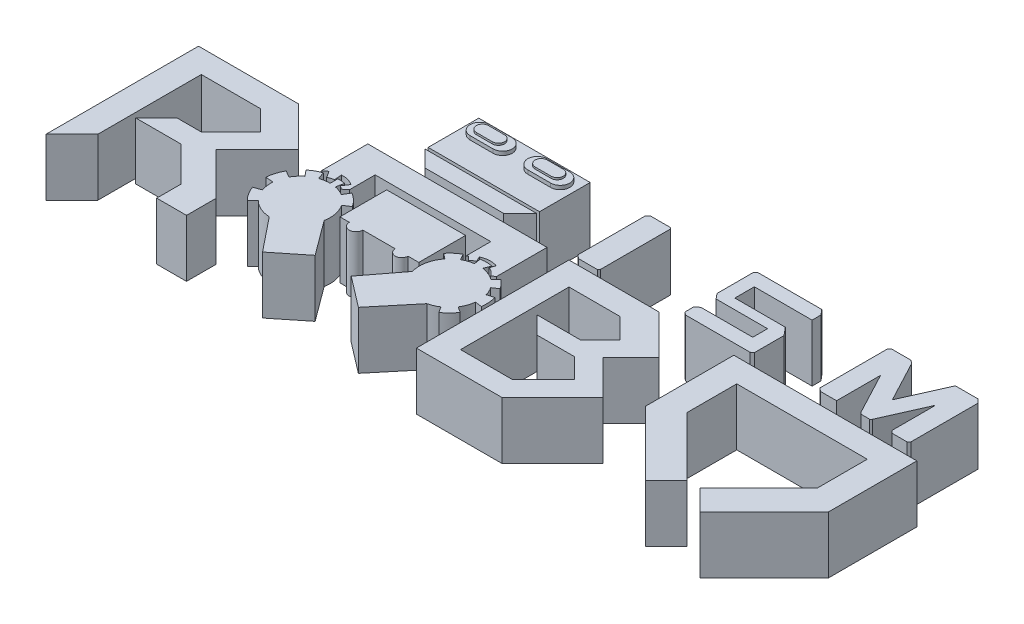
from build123d import *

# Parameters (mm, degrees)
BOSS_EXTRUDE1_DEPTH    = 15
BOSS_EXTRUDE1_2_DEPTH  = 15
BOSS_EXTRUDE1_3_DEPTH  = 15
BOSS_EXTRUDE1_4_DEPTH  = 15
BOSS_EXTRUDE1_5_DEPTH  = 15
BOSS_EXTRUDE1_6_DEPTH  = 15
SKETCH1_W              = 29.217576967
SKETCH1_H              = 13.279726958
BOSS_EXTRUDE1_7_DEPTH  = 15
BOSS_EXTRUDE1_8_DEPTH  = 15
BOSS_EXTRUDE1_9_DEPTH  = 15
BOSS_EXTRUDE1_10_DEPTH = 15
BOSS_EXTRUDE1_11_DEPTH = 15
BOSS_EXTRUDE1_12_DEPTH = 15
BOSS_EXTRUDE2_DEPTH    = 1
BOSS_EXTRUDE3_DEPTH    = 0.5


with BuildPart() as part:
    # Sketch1 → Boss-Extrude1 (new body)
    with BuildSketch(Plane(origin=(0, 0, 0), x_dir=(1, 0, 0), z_dir=(0, 1, 0))):
        Polygon((-166.060737531, 37.359722865), (-166.060737531, -2.640277135), (-159.262334495, 4.1581259), (-159.262334495, 31.288511702), (-143.776071096, 31.288511702), (-138.411695689, 25.924136295), (-146.100802771, 18.235029213), (-152.623896964, 18.235029213), (-158.034067728, 12.824858448), (-146.06823681, 12.824858448), (-137.027974425, 3.784596063), (-137.027974425, -2.640277135), (-129.20994928, -2.640277135), (-129.20994928, 5.099131264), (-140.245126365, 16.134308349), (-129.452100501, 26.927334212), (-139.884489154, 37.359722865), align=None)
    extrude(amount=BOSS_EXTRUDE1_DEPTH)


with BuildPart() as body_2:
    # Sketch1 → Boss-Extrude1 2 (new body)
    with BuildSketch(Plane(origin=(0, 0, 0), x_dir=(1, 0, 0), z_dir=(0, 1, 0))):
        with BuildLine():
            Line((-121.666954469, 37.359722865), (-121.666954469, 25.091839616))
            ThreePointArc((-121.666954469, 25.091839616), (-121.11847293, 25.608567653), (-120.503918812, 26.044644594))
            Line((-120.503918812, 26.044644594), (-119.46579592, 24.343392586))
            ThreePointArc((-119.46579592, 24.343392586), (-118.715472556, 24.685865618), (-117.905340229, 24.840651081))
            Line((-117.905340229, 24.840651081), (-118.042914174, 26.828874143))
            ThreePointArc((-118.042914174, 26.828874143), (-116.267022125, 26.65887271), (-114.641335974, 25.924136295))
            Line((-114.641335974, 25.924136295), (-115.748492584, 24.266981571))
            ThreePointArc((-115.748492584, 24.266981571), (-115.322258375, 23.930910762), (-114.953947662, 23.532204847))
            Line((-114.953947662, 23.532204847), (-113.666954469, 24.545816136))
            Line((-113.666954469, 24.545816136), (-113.666954469, 31.288511702))
            Line((-113.666954469, 31.288511702), (-83.350583894, 31.288511702))
            Line((-83.350583894, 31.288511702), (-83.350583894, 24.68641244))
            ThreePointArc((-83.350583894, 24.68641244), (-83.185755992, 24.893247524), (-83.011084386, 25.091839616))
            Line((-83.011084386, 25.091839616), (-81.944098855, 24.106422737))
            ThreePointArc((-81.944098855, 24.106422737), (-81.386957607, 24.606337061), (-80.746351097, 24.993563096))
            Line((-80.746351097, 24.993563096), (-81.377958095, 26.301453439))
            ThreePointArc((-81.377958095, 26.301453439), (-79.280603714, 26.836780469), (-77.140338017, 26.513155424))
            Line((-77.140338017, 26.513155424), (-77.638446965, 25.148827009))
            ThreePointArc((-77.638446965, 25.148827009), (-76.487463438, 24.495221576), (-75.613157067, 23.501465313))
            Line((-75.613157067, 23.501465313), (-74.666954469, 24.088304134))
            Line((-74.666954469, 24.088304134), (-74.666954469, 37.359722865))
            Line((-74.666954469, 37.359722865), (-121.666954469, 37.359722865))
        make_face()
    extrude(amount=BOSS_EXTRUDE1_2_DEPTH)


with BuildPart() as body_3:
    # Sketch1 → Boss-Extrude1 3 (new body)
    with BuildSketch(Plane(origin=(0, 0, 0), x_dir=(1, 0, 0), z_dir=(0, 1, 0))):
        with BuildLine():
            Line((-108.756618852, 29.396882537), (-88.068847529, 29.396882537))
            Line((-88.068847529, 29.396882537), (-88.068847529, 17.135937799))
            Line((-88.068847529, 17.135937799), (-90.899622258, 17.135937799))
            ThreePointArc((-90.899622258, 17.135937799), (-92.570416406, 15.465143652), (-94.241210553, 17.135937799))
            Line((-94.241210553, 17.135937799), (-102.72526578, 17.135937799))
            ThreePointArc((-102.72526578, 17.135937799), (-104.512405066, 15.348798514), (-106.299544351, 17.135937799))
            Line((-106.299544351, 17.135937799), (-108.756618852, 17.135937799))
            Line((-108.756618852, 17.135937799), (-108.756618852, 29.396882537))
        make_face()
    extrude(amount=BOSS_EXTRUDE1_3_DEPTH)


with BuildPart() as body_4:
    # Sketch1 → Boss-Extrude1 4 (new body)
    with BuildSketch(Plane(origin=(0, 0, 0), x_dir=(1, 0, 0), z_dir=(0, 1, 0))):
        Polygon((-68.928336566, 37.359722865), (-68.928336566, -2.640277135), (-63.43507269, -2.640277135), (-46.509966812, -2.640277135), (-33.26742794, 10.602261737), (-42.355184953, 19.69001875), (-34.970932538, 27.074271165), (-45.256384238, 37.359722865), align=None)
        Polygon((-62.787766468, 31.238708899), (-62.787766468, 2.800787384), (-49.185819215, 2.800787384), (-41.072040295, 10.914566304), (-46.29178234, 16.134308349), (-56.123317257, 16.134308349), (-60.70888867, 20.719879761), (-49.336952088, 20.719879761), (-44.132695554, 25.924136295), (-49.447268159, 31.238708899), align=None, mode=Mode.SUBTRACT)
    extrude(amount=BOSS_EXTRUDE1_4_DEPTH)


with BuildPart() as body_5:
    # Sketch1 → Boss-Extrude1 5 (new body)
    with BuildSketch(Plane(origin=(0, 0, 0), x_dir=(1, 0, 0), z_dir=(0, 1, 0))):
        Polygon((-25.676531545, 37.359722865), (-25.676531545, 14.233139026), (-8.803115383, -2.640277135), (-3.362050864, 2.800787384), (-18.796292692, 18.235029213), (-18.796292692, 31.238708899), (15.434241828, 31.238708899), (15.434241828, 18.235029213), (0, 2.800787384), (5.44106452, -2.640277135), (22.314480682, 14.233139026), (22.314480682, 37.359722865), align=None)
    extrude(amount=BOSS_EXTRUDE1_5_DEPTH)


with BuildPart() as body_6:
    # Sketch1 → Boss-Extrude1 6 (new body)
    with BuildSketch(Plane(origin=(0, 0, 0), x_dir=(1, 0, 0), z_dir=(0, 1, 0))):
        Polygon((-108.756618852, 39.391968934), (-88.068847529, 39.391968934), (-83.757156091, 43.703660372), (-113.068310289, 43.703660372), align=None)
    extrude(amount=BOSS_EXTRUDE1_6_DEPTH)


with BuildPart() as body_7:
    # Sketch1 → Boss-Extrude1 7 (new body)
    with BuildSketch(Plane(origin=(0, 0, 0), x_dir=(1, 0, 0), z_dir=(0, 1, 0))):
        with Locations((-98.359063982, 51.116475623)):
            Rectangle(SKETCH1_W, SKETCH1_H)
    extrude(amount=BOSS_EXTRUDE1_7_DEPTH)

    # Sketch2 → Boss-Extrude2 (add)
    with BuildSketch(Plane(origin=(0, 15, 0), x_dir=(1, 0, 0), z_dir=(0, 1, 0))):
        with BuildLine():
            Line((-109.118656844, 56.684213294), (-103.118656844, 56.684213294))
            ThreePointArc((-103.118656844, 56.684213294), (-100.600808239, 54.166364688), (-103.118656844, 51.648516083))
            Line((-103.118656844, 51.648516083), (-109.118656844, 51.648516083))
            ThreePointArc((-109.118656844, 51.648516083), (-111.63650545, 54.166364688), (-109.118656844, 56.684213294))
        make_face()
        with BuildLine():
            Line((-93.80461875, 56.477266833), (-87.80461875, 56.477266833))
            ThreePointArc((-87.80461875, 56.477266833), (-85.286770145, 53.959418227), (-87.80461875, 51.441569622))
            Line((-87.80461875, 51.441569622), (-93.80461875, 51.441569622))
            ThreePointArc((-93.80461875, 51.441569622), (-96.322467356, 53.959418227), (-93.80461875, 56.477266833))
        make_face()
    extrude(amount=BOSS_EXTRUDE2_DEPTH)

    # Sketch3 → Boss-Extrude3 (add)
    with BuildSketch(Plane(origin=(0, 16, 0), x_dir=(1, 0, 0), z_dir=(0, 1, 0))):
        with BuildLine():
            Line((-108.512890632, 55.853131981), (-104.312890632, 55.853131981))
            ThreePointArc((-104.312890632, 55.853131981), (-102.726266521, 54.26650787), (-104.312890632, 52.679883759))
            Line((-104.312890632, 52.679883759), (-108.512890632, 52.679883759))
            ThreePointArc((-108.512890632, 52.679883759), (-110.099514743, 54.26650787), (-108.512890632, 55.853131981))
        make_face()
        with BuildLine():
            Line((-92.983733842, 55.735604269), (-88.783733842, 55.735604269))
            ThreePointArc((-88.783733842, 55.735604269), (-87.197109731, 54.148980158), (-88.783733842, 52.562356047))
            Line((-88.783733842, 52.562356047), (-92.983733842, 52.562356047))
            ThreePointArc((-92.983733842, 52.562356047), (-94.570357953, 54.148980158), (-92.983733842, 55.735604269))
        make_face()
    extrude(amount=BOSS_EXTRUDE3_DEPTH)


with BuildPart() as body_8:
    # Sketch1 → Boss-Extrude1 8 (new body)
    with BuildSketch(Plane(origin=(0, 0, 0), x_dir=(1, 0, 0), z_dir=(0, 1, 0))):
        Polygon((-68.928336566, 57.42166931), (-68.928336566, 39.685660071), (-67.959875782, 38.92773424), (-63.012284709, 38.92773424), (-62.657553329, 39.381002114), (-62.657553329, 57.716021544), (-62.994071367, 58.052539582), (-68.297466294, 58.052539582), align=None)
    extrude(amount=BOSS_EXTRUDE1_8_DEPTH)


with BuildPart() as body_9:
    # Sketch1 → Boss-Extrude1 9 (new body)
    with BuildSketch(Plane(origin=(0, 0, 0), x_dir=(1, 0, 0), z_dir=(0, 1, 0))):
        Polygon((-6.961782548, 58.998793805), (-6.961782548, 41.201797781), (-6.07974156, 40.495742101), (-1.875291914, 40.495742101), (-1.875291914, 52.046752693), (3.967299717, 41.024145283), (4.450049711, 40.637713836), (6.683729379, 40.637713836), (7.066759423, 41.020743881), (12.134960905, 52.462707198), (12.134960905, 40.957790296), (12.703487901, 40.389263299), (16.740118661, 40.389263299), (17.222168374, 40.871313012), (17.222168374, 58.488166819), (16.251664735, 59.458670459), (10.309165195, 59.458670459), (5.238025455, 48.010073736), (-0.495979658, 58.827822302), (-1.326350507, 59.458670459), (-6.501905894, 59.458670459), align=None)
    extrude(amount=BOSS_EXTRUDE1_9_DEPTH)


with BuildPart() as body_10:
    # Sketch1 → Boss-Extrude1 10 (new body)
    with BuildSketch(Plane(origin=(0, 0, 0), x_dir=(1, 0, 0), z_dir=(0, 1, 0))):
        Polygon((-41.916078071, 58.700907263), (-41.916078071, 49.176896273), (-40.771322852, 47.808167207), (-27.282649773, 47.808167207), (-27.282649773, 43.918329151), (-40.878407154, 43.918329151), (-41.916078071, 43.05045893), (-41.916078071, 40.758360337), (-41.124443905, 40.164183121), (-24.227334269, 40.164183121), (-23.573734418, 40.710830269), (-23.573734418, 48.421500911), (-25.292692631, 50.476777036), (-38.533393606, 50.476777036), (-38.533393606, 55.593542867), (-23.396405336, 55.593542867), (-23.396405336, 57.920242473), (-24.546651452, 59.288953279), (-41.21634527, 59.288953279), align=None)
    extrude(amount=BOSS_EXTRUDE1_10_DEPTH)


with BuildPart() as body_11:
    # Sketch1 → Boss-Extrude1 11 (new body)
    with BuildSketch(Plane(origin=(0, 0, 0), x_dir=(1, 0, 0), z_dir=(0, 1, 0))):
        with BuildLine():
            Line((-110.916014774, -0.993495456), (-103.267100087, 5.145436791))
            Line((-103.267100087, 5.145436791), (-109.997089197, 14.233139026))
            ThreePointArc((-109.997089197, 14.233139026), (-110.013565374, 17.217541153), (-111.148853999, 19.977622177))
            Line((-111.148853999, 19.977622177), (-109.449477115, 21.097290431))
            ThreePointArc((-109.449477115, 21.097290431), (-110.850951669, 22.781149225), (-112.590232279, 24.113220664))
            Line((-112.590232279, 24.113220664), (-113.640100014, 22.369857096))
            ThreePointArc((-113.640100014, 22.369857096), (-114.850666213, 22.962985232), (-116.145231101, 23.338981592))
            Line((-116.145231101, 23.338981592), (-115.748492584, 25.335011988))
            ThreePointArc((-115.748492584, 25.335011988), (-116.703089001, 25.476508395), (-117.666954469, 25.52382554))
            Line((-117.666954469, 25.52382554), (-117.666954469, 23.488748443))
            ThreePointArc((-117.666954469, 23.488748443), (-118.98136595, 23.377285011), (-120.258238532, 23.046078053))
            Line((-120.258238532, 23.046078053), (-120.933829259, 24.965743639))
            ThreePointArc((-120.933829259, 24.965743639), (-122.459640256, 24.277876697), (-123.846816202, 23.341392303))
            Line((-123.846816202, 23.341392303), (-122.568818866, 21.757643081))
            ThreePointArc((-122.568818866, 21.757643081), (-123.626031819, 20.724713336), (-124.469578931, 19.511011827))
            Line((-124.469578931, 19.511011827), (-126.243135938, 20.509027025))
            ThreePointArc((-126.243135938, 20.509027025), (-127.08430706, 18.538648761), (-127.479125326, 16.432923733))
            Line((-127.479125326, 16.432923733), (-125.449965328, 16.277847969))
            ThreePointArc((-125.449965328, 16.277847969), (-125.405767156, 14.663321373), (-125.030235245, 13.092453653))
            Line((-125.030235245, 13.092453653), (-126.949964651, 12.417044294))
            ThreePointArc((-126.949964651, 12.417044294), (-125.994928666, 10.440345692), (-124.625439198, 8.724557333))
            Line((-124.625439198, 8.724557333), (-123.186422382, 10.163574148))
            ThreePointArc((-123.186422382, 10.163574148), (-120.826923296, 8.545560075), (-118.042914174, 7.886394936))
            Line((-118.042914174, 7.886394936), (-110.916014774, -0.993495456))
        make_face()
    extrude(amount=BOSS_EXTRUDE1_11_DEPTH)


with BuildPart() as body_12:
    # Sketch1 → Boss-Extrude1 12 (new body)
    with BuildSketch(Plane(origin=(0, 0, 0), x_dir=(1, 0, 0), z_dir=(0, 1, 0))):
        with BuildLine():
            Line((-86.857702074, 14.233139026), (-93.810320972, 5.145436791))
            Line((-93.810320972, 5.145436791), (-85.786180843, -0.993495456))
            Line((-85.786180843, -0.993495456), (-77.638446965, 8.821327559))
            ThreePointArc((-77.638446965, 8.821327559), (-76.301639467, 9.254889405), (-75.064240998, 9.921128995))
            Line((-75.064240998, 9.921128995), (-74.067000014, 8.412387282))
            ThreePointArc((-74.067000014, 8.412387282), (-72.537750955, 9.667116121), (-71.297659489, 11.208258653))
            Line((-71.297659489, 11.208258653), (-72.815840636, 12.19106949))
            ThreePointArc((-72.815840636, 12.19106949), (-72.023390945, 13.79090915), (-71.615189356, 15.528964072))
            Line((-71.615189356, 15.528964072), (-69.818824891, 15.319522328))
            ThreePointArc((-69.818824891, 15.319522328), (-69.788301875, 17.242719269), (-70.141217552, 19.133504464))
            Line((-70.141217552, 19.133504464), (-71.87693679, 18.625498694))
            ThreePointArc((-71.87693679, 18.625498694), (-72.308264029, 19.762167743), (-72.910860429, 20.818073655))
            Line((-72.910860429, 20.818073655), (-71.414694768, 21.834085196))
            ThreePointArc((-71.414694768, 21.834085196), (-72.316340899, 22.967630452), (-73.378041376, 23.952862753))
            Line((-73.378041376, 23.952862753), (-74.666954469, 22.66394966))
            ThreePointArc((-74.666954469, 22.66394966), (-76.404973962, 23.654232354), (-78.337607909, 24.170272663))
            Line((-78.337607909, 24.170272663), (-77.638446965, 25.890245793))
            ThreePointArc((-77.638446965, 25.890245793), (-79.19005352, 26.045509092), (-80.746351097, 25.947900455))
            Line((-80.746351097, 25.947900455), (-80.487140514, 24.158039843))
            ThreePointArc((-80.487140514, 24.158039843), (-81.899613744, 23.816817659), (-83.224366241, 23.219704582))
            Line((-83.224366241, 23.219704582), (-84.117774737, 24.79215884))
            ThreePointArc((-84.117774737, 24.79215884), (-85.597709995, 23.756106036), (-86.857702074, 22.461488818))
            Line((-86.857702074, 22.461488818), (-85.448886324, 21.327456492))
            ThreePointArc((-85.448886324, 21.327456492), (-87.024579413, 17.953320793), (-86.857702074, 14.233139026))
        make_face()
    extrude(amount=BOSS_EXTRUDE1_12_DEPTH)


solid = Compound([part.part, body_2.part, body_3.part, body_4.part, body_5.part, body_6.part, body_7.part, body_8.part, body_9.part, body_10.part, body_11.part, body_12.part])
